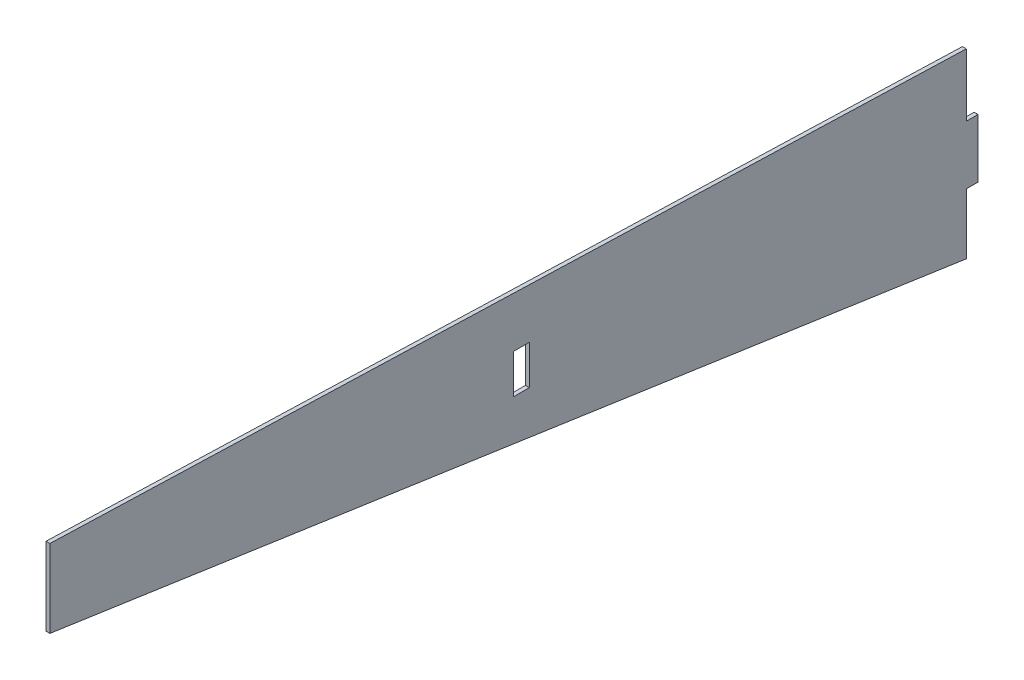
from build123d import *

# Parameters (mm, degrees)
BOSS_EXTRUDE1_DEPTH = 1.5875
CUT_EXTRUDE2_DEPTH  = 383.274521188
SKETCH4_W           = 6.35
SKETCH4_H           = 16.002
CUT_EXTRUDE3_DEPTH  = 1.5875


with BuildPart() as part:
    # Sketch1 → Boss-Extrude1 (new body)
    with BuildSketch(Plane(origin=(0, 0, 0), x_dir=(0, 0, -1), z_dir=(1, 0, 0))):
        Polygon((0, 0), (0, 31.75), (378.259807404, 19.441884667), (378.259807404, -55.234115333), align=None)
    extrude(amount=BOSS_EXTRUDE1_DEPTH)

    # Sketch3 → Cut-Extrude2 (cut, through all)
    with BuildSketch(Plane(origin=(1.5875, 0, 0), x_dir=(0, 0, -1), z_dir=(1, 0, 0))):
        Polygon((378.259807404, -55.234115333), (378.259807404, -29.834115333), (373.497307404, -29.834115333), (373.497307404, -54.538687299), align=None)
        Polygon((378.259807404, 19.441884667), (373.497307404, 19.59685064), (373.497307404, -5.958115333), (378.259807404, -5.958115333), align=None)
    extrude(amount=-CUT_EXTRUDE2_DEPTH, mode=Mode.SUBTRACT)

    # Sketch4 → Cut-Extrude3 (cut)
    with BuildSketch(Plane(origin=(1.5875, 0, 0), x_dir=(0, 0, -1), z_dir=(1, 0, 0))):
        with Locations((192.204807404, -2.939176237)):
            Rectangle(SKETCH4_W, SKETCH4_H)
    extrude(amount=-CUT_EXTRUDE3_DEPTH, mode=Mode.SUBTRACT)


solid = part.part
